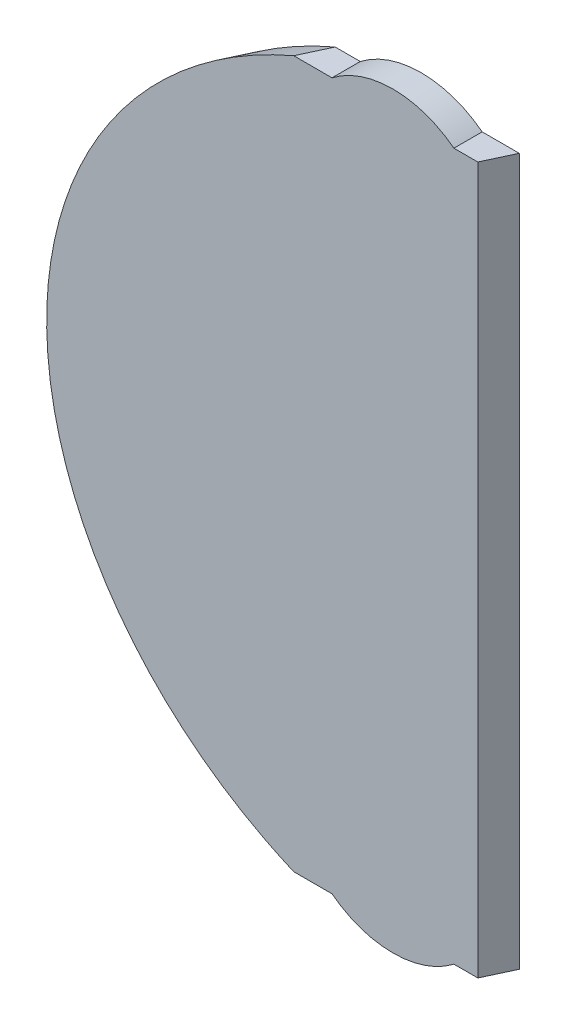
from build123d import *

# Parameters (mm, degrees)
EXTRUDE1_DEPTH = 0.47645
EXTRUDE2_DEPTH = 0.431810345
EXTRUDE3_START = -0.431810345
EXTRUDE3_DEPTH = 0.431810345


with BuildPart() as part:
    # Sketch2 → Extrude1 (new, symmetric, along a direction that is not the sketch's normal)
    with BuildSketch(Plane.XY):
        with BuildLine():
            Line((0, -10.795), (-5.624340933, -10.795))
            add(Edge.make_bspline(
                [(-5.624340933, 10.795), (-30.848340464, 0), (-5.624340933, -10.795)],
                knots=[5.153552835, 5.153552835, 5.153552835, 7.41281778, 7.41281778, 7.41281778], degree=2, weights=[1, 0.426992175, 1]))
            Line((-5.624340933, 10.795), (0, 10.795))
            Line((0, 10.795), (0, -10.795))
        make_face()
    extrude(amount=EXTRUDE1_DEPTH, dir=(-0.42261826174069717, 0, 0.906307787036651), both=True)

    # Sketch4 → Extrude2 (add)
    with BuildSketch(Plane.XY):
        with BuildLine():
            Line((-4.656185544, -10.795), (-0.931814456, -10.795))
            ThreePointArc((-0.931814456, -10.795), (-2.794, -11.43), (-4.656185544, -10.795))
        make_face()
        with BuildLine():
            Line((-4.656185544, 10.795), (-0.931814456, 10.795))
            ThreePointArc((-0.931814456, 10.795), (-2.794, 11.43), (-4.656185544, 10.795))
        make_face()
    extrude(amount=EXTRUDE2_DEPTH)

    # Sketch4<2> → Extrude3 (add)
    with BuildSketch(Plane.XY.offset(EXTRUDE3_START)):
        with BuildLine():
            Line((-4.656185544, -10.795), (-0.931814456, -10.795))
            ThreePointArc((-0.931814456, -10.795), (-2.794, -11.43), (-4.656185544, -10.795))
        make_face()
        with BuildLine():
            Line((-4.656185544, 10.795), (-0.931814456, 10.795))
            ThreePointArc((-0.931814456, 10.795), (-2.794, 11.43), (-4.656185544, 10.795))
        make_face()
    extrude(amount=EXTRUDE3_DEPTH)


solid = part.part
